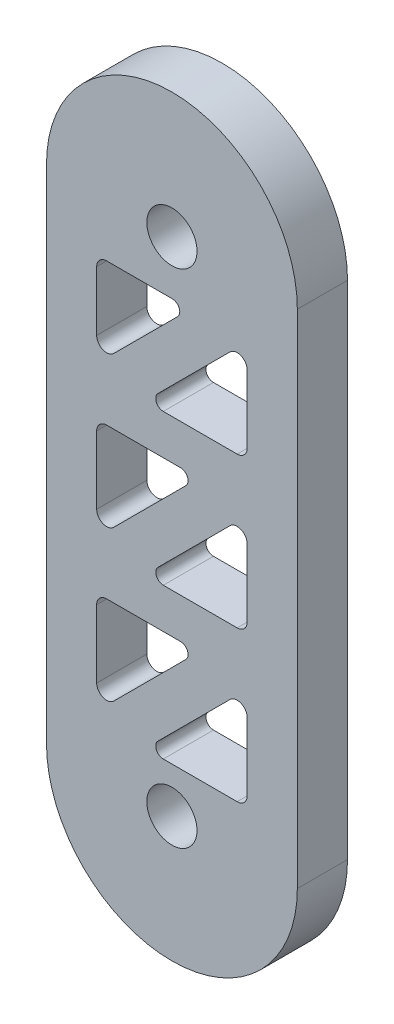
from build123d import *

# Parameters (mm, degrees)
SKETCH1_R           = 5
BOSS_EXTRUDE1_DEPTH = 10
CUT_EXTRUDE2_DEPTH  = 10
FILLET1_R           = 2


with BuildPart() as part:
    # Sketch1 → Boss-Extrude1 (new body)
    # profile 1 of 2: a face of its own
    with BuildSketch(Plane.XY):
        with BuildLine():
            Line((0, 0), (0, 100))
            ThreePointArc((0, 100), (25, 125), (50, 100))
            Line((50, 100), (50, 0))
            ThreePointArc((50, 0), (25, -25), (0, 0))
        make_face()
        with BuildLine():
            ThreePointArc((15, 0), (25, -10), (35, 0))
            Line((35, 0), (35, 100))
            ThreePointArc((35, 100), (25, 110), (15, 100))
            Line((15, 100), (15, 0))
        make_face(mode=Mode.SUBTRACT)
    # profile 2 of 2: a face of its own
    with BuildSketch(Plane.XY):
        with BuildLine():
            Line((15, 0), (15, 100))
            ThreePointArc((15, 100), (25, 110), (35, 100))
            Line((35, 100), (35, 0))
            ThreePointArc((35, 0), (25, -10), (15, 0))
        make_face()
        with Locations((25, 0)):
            Circle(SKETCH1_R, mode=Mode.SUBTRACT)
        with Locations((25, 100)):
            Circle(SKETCH1_R, mode=Mode.SUBTRACT)
    extrude(amount=BOSS_EXTRUDE1_DEPTH)

    # Sketch2 → Cut-Extrude2 (cut)
    with BuildSketch(Plane.XY.offset(10)):
        with BuildLine():
            Line((25.064971157, 89.343145751), (10, 89.343145751))
            Line((10, 89.343145751), (10, 70.656854249))
            Line((10, 70.656854249), (26.125631329, 86.782485579))
            ThreePointArc((26.125631329, 86.782485579), (26.450790456, 88.417170899), (25.064971157, 89.343145751))
        make_face()
        with BuildLine():
            Line((40, 69), (40, 89.343145751))
            Line((40, 89.343145751), (22.217514421, 71.560660172))
            ThreePointArc((22.217514421, 71.560660172), (21.892355294, 69.925974851), (23.278174593, 69))
            Line((23.278174593, 69), (40, 69))
        make_face()
        with BuildLine():
            Line((26.721825407, 61), (10, 61))
            Line((10, 61), (10, 40.65685425))
            Line((10, 40.65685425), (22.171572875, 52.828427125))
            Line((22.171572875, 52.828427125), (27.782485579, 58.439339828))
            ThreePointArc((27.782485579, 58.439339828), (28.107644706, 60.074025149), (26.721825407, 61))
        make_face()
        with BuildLine():
            Line((40, 39), (40, 59.343145751))
            Line((40, 59.343145751), (27.828427125, 47.171572875))
            Line((27.828427125, 47.171572875), (22.217514421, 41.560660172))
            ThreePointArc((22.217514421, 41.560660172), (21.892355294, 39.925974852), (23.278174593, 39))
            Line((23.278174593, 39), (40, 39))
        make_face()
        with BuildLine():
            Line((26.721825408, 31.000000001), (10, 31.000000001))
            Line((10, 31.000000001), (10, 10.656854249))
            Line((10, 10.656854249), (27.782485579, 28.439339829))
            ThreePointArc((27.782485579, 28.439339829), (28.107644706, 30.074025149), (26.721825408, 31.000000001))
        make_face()
        with BuildLine():
            Line((40, 9), (40, 29.34314575))
            Line((40, 29.34314575), (22.217514422, 11.560660171))
            ThreePointArc((22.217514422, 11.560660171), (21.892355295, 9.925974851), (23.278174594, 9))
            Line((23.278174594, 9), (40, 9))
        make_face()
    extrude(amount=-CUT_EXTRUDE2_DEPTH, mode=Mode.SUBTRACT)

    # Fillet1
    fillet1_edges = [part.edges().sort_by_distance(p)[0] for p in [
        (10, 10.656854249, 5),
        (10, 31.000000001, 5),
        (40, 59.343145751, 5),
        (40, 39, 5),
        (10, 40.65685425, 5),
        (10, 61, 5),
        (40, 89.343145751, 5),
        (40, 69, 5),
        (40, 29.34314575, 5),
        (40, 9, 5),
        (10, 70.656854249, 5),
        (10, 89.343145751, 5),
    ]]
    fillet(fillet1_edges, radius=FILLET1_R)


solid = part.part
